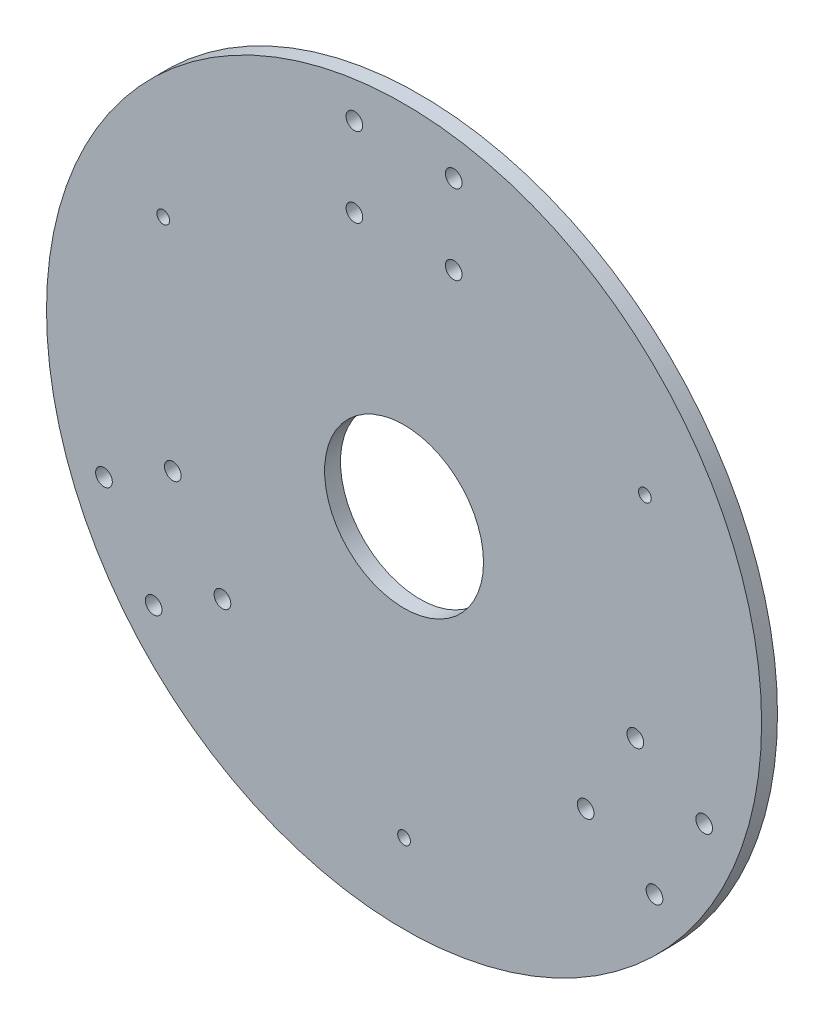
from build123d import *

# Parameters (mm, degrees)
SKETCH_1_R          = 90
SKETCH_1_R_2        = 2.1
SKETCH_1_R_3        = 20
EXTRUDE_1_DEPTH     = 4
SKETCH_2_R          = 1.6
CUT_EXTRUDE_1_DEPTH = 10


with BuildPart() as part:
    # 草图1 → 凸台-拉伸1 (new body)
    with BuildSketch(Plane.XY):
        Circle(SKETCH_1_R)
        with Locations((12.5, 80)):
            Circle(SKETCH_1_R_2, mode=Mode.SUBTRACT)
        with Locations((-12.5, 80)):
            Circle(SKETCH_1_R_2, mode=Mode.SUBTRACT)
        with Locations(Location((12.5, 60, 0), (0, 0, 180))):
            Circle(SKETCH_1_R_2, mode=Mode.SUBTRACT)
        with Locations(Location((-12.5, 60, 0), (0, 0, 180))):
            Circle(SKETCH_1_R_2, mode=Mode.SUBTRACT)
        Circle(SKETCH_1_R_3, mode=Mode.SUBTRACT)
        with Locations((75.532032303, -29.174682453)):
            Circle(SKETCH_1_R_2, mode=Mode.SUBTRACT)
        with Locations(Location((58.211524227, -19.174682453, 0), (0, 0, 180))):
            Circle(SKETCH_1_R_2, mode=Mode.SUBTRACT)
        with Locations(Location((45.711524227, -40.825317547, 0), (0, 0, 180))):
            Circle(SKETCH_1_R_2, mode=Mode.SUBTRACT)
        with Locations((63.032032303, -50.825317547)):
            Circle(SKETCH_1_R_2, mode=Mode.SUBTRACT)
        with Locations((-63.032032303, -50.825317547)):
            Circle(SKETCH_1_R_2, mode=Mode.SUBTRACT)
        with Locations(Location((-45.711524227, -40.825317547, 0), (0, 0, 180))):
            Circle(SKETCH_1_R_2, mode=Mode.SUBTRACT)
        with Locations(Location((-58.211524227, -19.174682453, 0), (0, 0, 180))):
            Circle(SKETCH_1_R_2, mode=Mode.SUBTRACT)
        with Locations((-75.532032303, -29.174682453)):
            Circle(SKETCH_1_R_2, mode=Mode.SUBTRACT)
    extrude(amount=EXTRUDE_1_DEPTH)

    # 草图2 → 切除-拉伸1 (cut)
    with BuildSketch(Plane.XY.offset(4)):
        with Locations((0, -70)):
            Circle(SKETCH_2_R)
        with Locations((-60.621778265, 35)):
            Circle(SKETCH_2_R)
        with Locations((60.621778265, 35)):
            Circle(SKETCH_2_R)
    extrude(amount=-CUT_EXTRUDE_1_DEPTH, mode=Mode.SUBTRACT)


solid = part.part
